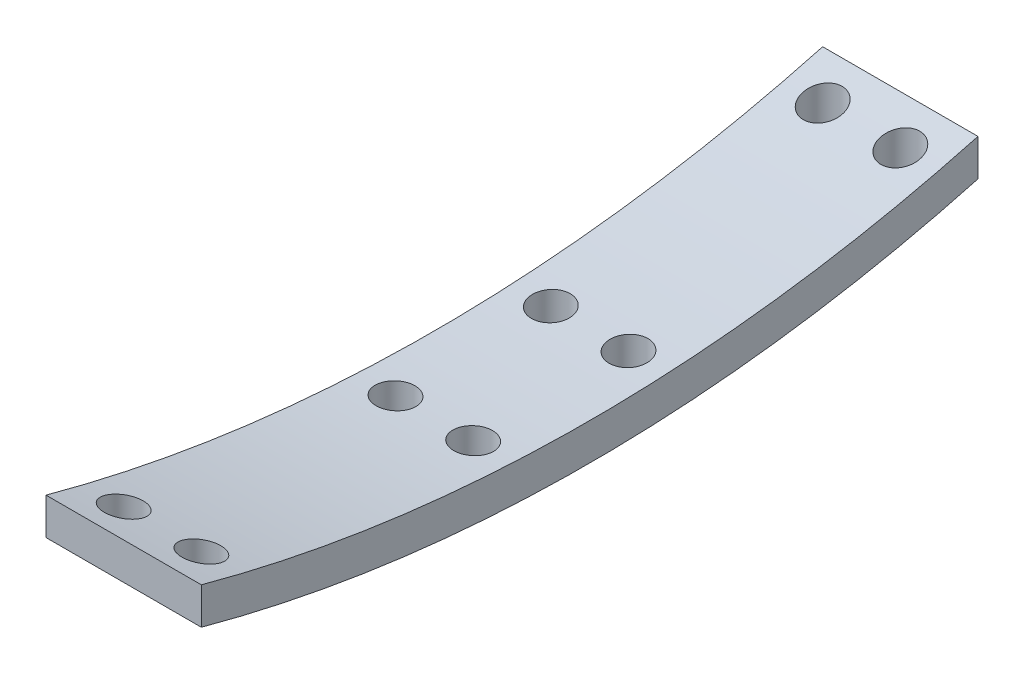
from build123d import *

# Parameters (mm, degrees)
BOSS_EXTRUDE4_DEPTH = 304.8
SKETCH4_OUTSIDE_W   = 384.928
SKETCH4_OUTSIDE_H   = 321.428
SKETCH4_OUTSIDE_W_2 = 25.4
SKETCH4_OUTSIDE_H_2 = 127
CUT_EXTRUDE2_DEPTH  = 150
SKETCH6_R           = 3.175
CUT_EXTRUDE4_DEPTH  = 150
SKETCH5_R           = 3.175
CUT_EXTRUDE5_DEPTH  = 150


with BuildPart() as part:
    # Sketch3 → Boss-Extrude4 (new body)
    with BuildSketch(Plane(origin=(0, 0, 0), x_dir=(0, 0, -1), z_dir=(1, 0, 0))):
        with BuildLine():
            ThreePointArc((232.90669496, 1.961354585), (112.25669496, -30.366715482), (-8.39330504, 1.961354585))
            Line((-8.39330504, 1.961354585), (-8.39330504, -4.052041589))
            ThreePointArc((-8.39330504, -4.052041589), (112.25669496, -36.380111656), (232.90669496, -4.052041589))
            Line((232.90669496, -4.052041589), (232.90669496, 1.961354585))
        make_face()
    extrude(amount=BOSS_EXTRUDE4_DEPTH)

    # Sketch4 outside → Cut-Extrude2 (cut)
    with BuildSketch(Plane(origin=(0, 1.961354585, 0), x_dir=(1, 0, 0), z_dir=(0, 1, 0))):
        with Locations((152.4, 112.257)):
            Rectangle(SKETCH4_OUTSIDE_W, SKETCH4_OUTSIDE_H)
        with Locations((41.389045768, 112.25669496)):
            Rectangle(SKETCH4_OUTSIDE_W_2, SKETCH4_OUTSIDE_H_2, mode=Mode.SUBTRACT)
    extrude(amount=-CUT_EXTRUDE2_DEPTH, mode=Mode.SUBTRACT)

    # Sketch6 → Cut-Extrude4 (cut)
    with BuildSketch(Plane(origin=(0, 1.961354585, 0), x_dir=(1, 0, 0), z_dir=(0, 1, 0))):
        with Locations(Location((35.039045768, 124.95669496, 0), (0, 0, 270))):
            Circle(SKETCH6_R)
        with Locations(Location((47.739045768, 124.95669496, 0), (0, 0, 270))):
            Circle(SKETCH6_R)
        with Locations(Location((35.039045768, 99.55669496, 0), (0, 0, 270))):
            Circle(SKETCH6_R)
        with Locations(Location((47.739045768, 99.55669496, 0), (0, 0, 270))):
            Circle(SKETCH6_R)
    extrude(amount=-CUT_EXTRUDE4_DEPTH, mode=Mode.SUBTRACT)

    # Sketch5 → Cut-Extrude5 (cut)
    with BuildSketch(Plane(origin=(0, 1.961354585, 0), x_dir=(1, 0, 0), z_dir=(0, 1, 0))):
        with Locations(Location((47.739045768, 169.40669496, 0), (0, 0, 270))):
            Circle(SKETCH5_R)
        with Locations(Location((35.039045768, 169.40669496, 0), (0, 0, 270))):
            Circle(SKETCH5_R)
        with Locations(Location((35.039045768, 55.10669496, 0), (0, 0, 270))):
            Circle(SKETCH5_R)
        with Locations(Location((47.739045768, 55.10669496, 0), (0, 0, 270))):
            Circle(SKETCH5_R)
    extrude(amount=-CUT_EXTRUDE5_DEPTH, mode=Mode.SUBTRACT)


solid = part.part
